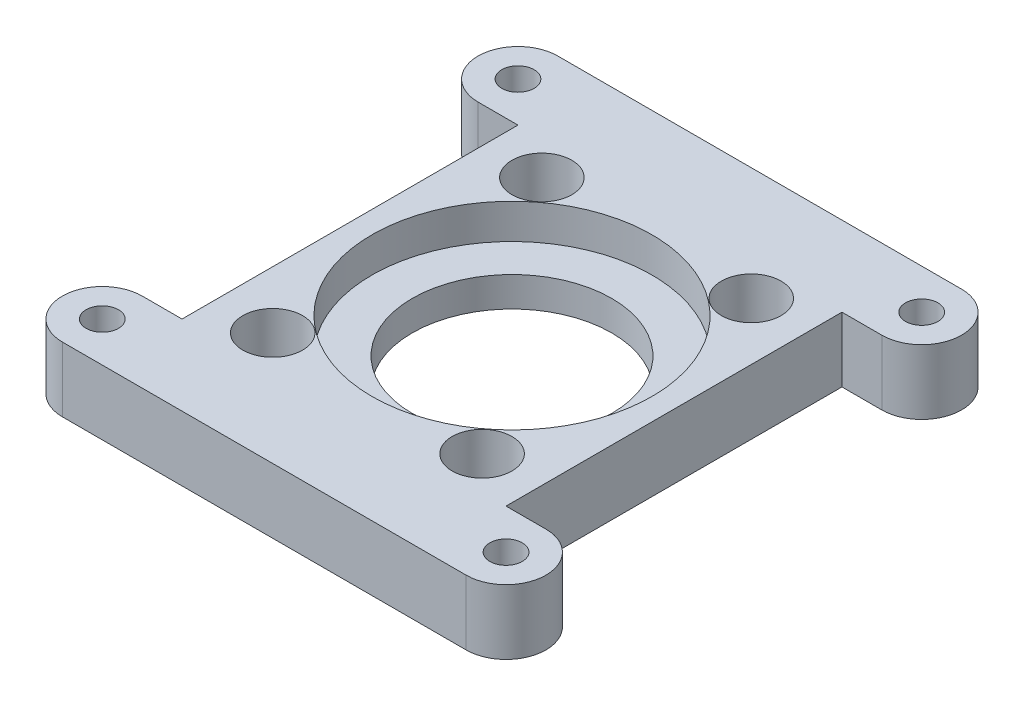
from build123d import *
from build123d.topology import SkipClean

# Parameters (mm, degrees)
SKETCH1_R            = 1.375
SKETCH1_R_2          = 1.460845326
SKETCH1_R_3          = 1.480655282
BOSS_EXTRUDE1_DEPTH  = 15
BOSS_EXTRUDE2_START  = -8
SKETCH2_R            = 14
SKETCH2_R_2          = 10
BOSS_EXTRUDE2_DEPTH  = 8
CUT_EXTRUDE1_START   = -3
SKETCH3_R            = 14
SKETCH3_R_2          = 10
CUT_EXTRUDE1_DEPTH   = 3
SKETCH5_R            = 1.480655282
SKETCH5_R_2          = 1.375
SKETCH5_R_3          = 1.460845326
BOSS_EXTRUDE3_DEPTH  = 0.5
SKETCH6_W            = 32.415484222
SKETCH6_H            = 34.71462202
CUT_EXTRUDE2_DEPTH   = 7
SKETCH7_W            = 33.435139342
SKETCH7_H            = 35.82697306
CUT_EXTRUDE3_DEPTH   = 2
BOSS_EXTRUDE4_DEPTH  = 6.5
SKETCH9_R            = 3.5
SKETCH9_R_2          = 1.625
CUT_EXTRUDE4_DEPTH   = 3
SKETCH10_R           = 3
CUT_EXTRUDE5_DEPTH   = 28
SKETCH11_R           = 14.05
CUT_EXTRUDE6_DEPTH   = 3.5
SKETCH12_W           = 30
SKETCH12_H           = 8
SKETCH12_H_2         = 7.99555269
BOSS_EXTRUDE5_DEPTH  = 6.5
BOSS_EXTRUDE8_DEPTH  = 6.5
BOSS_EXTRUDE9_START  = -3
SKETCH15_R           = 14.05
SKETCH15_R_2         = 14
BOSS_EXTRUDE9_DEPTH  = 3
SKETCH16_R           = 4
SKETCH16_R_2         = 1.625
BOSS_EXTRUDE10_DEPTH = 6.5


with BuildPart() as part:
    # Sketch1 → Boss-Extrude1 (new body)
    with BuildSketch(Plane(origin=(0, 0, 0), x_dir=(1, 0, 0), z_dir=(0, 1, 0))):
        with BuildLine():
            Line((-15, -16.85), (15, -16.85))
            Line((15, -16.85), (15, 16.85))
            Line((15, 16.85), (-15, 16.85))
            Line((-15, 16.85), (-15, 2.633913438))
            ThreePointArc((-15, 2.633913438), (0.072875656, 13.937359865), (12.75, 0))
            ThreePointArc((12.75, 0), (0.072875656, -13.937359865), (-15, -2.633913438))
            Line((-15, -2.633913438), (-15, -16.85))
        make_face()
        with Locations(Location((-11.75, -13.5, 0), (0, 0, 270))):
            Circle(SKETCH1_R, mode=Mode.SUBTRACT)
        with Locations(Location((9.25, -13.5, 0), (0, 0, 270))):
            Circle(SKETCH1_R_2, mode=Mode.SUBTRACT)
        with Locations(Location((-11.75, 13.5, 0), (0, 0, 270))):
            Circle(SKETCH1_R, mode=Mode.SUBTRACT)
        with Locations(Location((9.25, 13.5, 0), (0, 0, 270))):
            Circle(SKETCH1_R_3, mode=Mode.SUBTRACT)
    extrude(amount=BOSS_EXTRUDE1_DEPTH)

    # Sketch2 → Boss-Extrude2 (add)
    with BuildSketch(Plane(origin=(0, 15, 0), x_dir=(1, 0, 0), z_dir=(0, 1, 0)).offset(BOSS_EXTRUDE2_START)):
        with Locations((-1.25, 0)):
            Circle(SKETCH2_R)
        with Locations(Location((-1.25, 0, 0), (0, 0, 270))):
            Circle(SKETCH2_R_2, mode=Mode.SUBTRACT)
    extrude(amount=BOSS_EXTRUDE2_DEPTH)

    # Sketch3 → Cut-Extrude1 (cut)
    with BuildSketch(Plane(origin=(0, 15, 0), x_dir=(1, 0, 0), z_dir=(0, 1, 0)).offset(CUT_EXTRUDE1_START)):
        with Locations((-1.25, 0)):
            Circle(SKETCH3_R)
        with Locations(Location((-1.25, 0, 0), (0, 0, 270))):
            Circle(SKETCH3_R_2, mode=Mode.SUBTRACT)
    extrude(amount=CUT_EXTRUDE1_DEPTH, mode=Mode.SUBTRACT)

    # Sketch5 → Boss-Extrude3 (add)
    with BuildSketch(Plane(origin=(0, 15, 0), x_dir=(1, 0, 0), z_dir=(0, 1, 0))):
        with BuildLine():
            Line((-15, 16.85), (-15, 2.633913438))
            ThreePointArc((-15, 2.633913438), (12.75, 0), (-15, -2.633913438))
            Line((-15, -2.633913438), (-15, -16.85))
            Line((-15, -16.85), (15, -16.85))
            Line((15, -16.85), (15, 16.85))
            Line((15, 16.85), (-15, 16.85))
        make_face()
        with Locations(Location((9.25, 13.5, 0), (0, 0, 270))):
            Circle(SKETCH5_R, mode=Mode.SUBTRACT)
        with Locations(Location((-11.75, -13.5, 0), (0, 0, 270))):
            Circle(SKETCH5_R_2, mode=Mode.SUBTRACT)
        with Locations(Location((-11.75, 13.5, 0), (0, 0, 270))):
            Circle(SKETCH5_R_2, mode=Mode.SUBTRACT)
        with Locations(Location((9.25, -13.5, 0), (0, 0, 270))):
            Circle(SKETCH5_R_3, mode=Mode.SUBTRACT)
    extrude(amount=BOSS_EXTRUDE3_DEPTH)

    # Sketch6 → Cut-Extrude2 (cut)
    with BuildSketch(Plane.XZ):
        Rectangle(SKETCH6_W, SKETCH6_H)
    extrude(amount=-CUT_EXTRUDE2_DEPTH, mode=Mode.SUBTRACT)

    # Sketch7 → Cut-Extrude3 (cut)
    with BuildSketch(Plane.XZ.offset(-7)):
        Rectangle(SKETCH7_W, SKETCH7_H)
    extrude(amount=-CUT_EXTRUDE3_DEPTH, mode=Mode.SUBTRACT)

    # Sketch8 → Boss-Extrude4 (add)
    with BuildSketch(Plane.XZ.offset(-9)):
        with BuildLine():
            Line((3.5, 16.85), (3.5, 20.35))
            ThreePointArc((3.5, 20.35), (2.474873725, 17.875126257), (-2.6e-08, 16.85))
            Line((-2.6e-08, 16.85), (3.5, 16.85))
        make_face()
        with BuildLine():
            ThreePointArc((-2.6e-08, 16.85), (-2.474873743, 17.875126275), (-3.5, 20.35))
            Line((-3.5, 20.35), (-3.5, 16.85))
            Line((-3.5, 16.85), (-2.6e-08, 16.85))
        make_face()
        with BuildLine():
            ThreePointArc((-1.625, 20.35), (0, 21.975), (1.625, 20.35))
            Line((1.625, 20.35), (3.5, 20.35))
            ThreePointArc((3.5, 20.35), (0, 23.85), (-3.5, 20.35))
            Line((-3.5, 20.35), (-1.625, 20.35))
        make_face()
        with BuildLine():
            Line((3.5, 20.35), (1.625, 20.35))
            ThreePointArc((1.625, 20.35), (0, 18.725), (-1.625, 20.35))
            Line((-1.625, 20.35), (-3.5, 20.35))
            ThreePointArc((-3.5, 20.35), (-2.474873743, 17.875126275), (-2.6e-08, 16.85))
            ThreePointArc((-2.6e-08, 16.85), (2.474873725, 17.875126257), (3.5, 20.35))
        make_face()
        with BuildLine():
            Line((3.5, -20.35), (3.5, -16.85))
            Line((3.5, -16.85), (0, -16.85))
            ThreePointArc((0, -16.85), (2.474873734, -17.875126266), (3.5, -20.35))
        make_face()
        with BuildLine():
            ThreePointArc((-3.5, -20.35), (-2.474873734, -17.875126266), (0, -16.85))
            Line((0, -16.85), (-3.5, -16.85))
            Line((-3.5, -16.85), (-3.5, -20.35))
        make_face()
        with BuildLine():
            ThreePointArc((-3.5, -20.35), (0, -23.85), (3.5, -20.35))
            Line((3.5, -20.35), (1.625, -20.35))
            ThreePointArc((1.625, -20.35), (0, -21.975), (-1.625, -20.35))
            Line((-1.625, -20.35), (-3.5, -20.35))
        make_face()
        with BuildLine():
            Line((1.625, -20.35), (3.5, -20.35))
            ThreePointArc((3.5, -20.35), (2.474873734, -17.875126266), (0, -16.85))
            ThreePointArc((0, -16.85), (-2.474873734, -17.875126266), (-3.5, -20.35))
            Line((-3.5, -20.35), (-1.625, -20.35))
            ThreePointArc((-1.625, -20.35), (0, -18.725), (1.625, -20.35))
        make_face()
    extrude(amount=-BOSS_EXTRUDE4_DEPTH)

    # Sketch9 → Cut-Extrude4 (cut)
    # profile 1 of 2: a face of its own
    with BuildSketch(Plane.XZ.offset(-9)):
        with Locations((0, 20.35)):
            Circle(SKETCH9_R)
        with Locations(Location((0, 20.35, 0), (0, 0, 270))):
            Circle(SKETCH9_R_2, mode=Mode.SUBTRACT)
    # profile 2 of 2: a face of its own
    with BuildSketch(Plane.XZ.offset(-9)):
        with Locations((0, -20.35)):
            Circle(SKETCH9_R)
        with Locations(Location((0, -20.35, 0), (0, 0, 270))):
            Circle(SKETCH9_R_2, mode=Mode.SUBTRACT)
    extrude(amount=-CUT_EXTRUDE4_DEPTH, mode=Mode.SUBTRACT)

    # Sketch10 → Cut-Extrude5 (cut)
    with BuildSketch(Plane.XZ.offset(-9)):
        with Locations(Location((-11.75, 13.5, 0), (0, 0, 270))):
            Circle(SKETCH10_R)
        with Locations(Location((9.25, 13.5, 0), (0, 0, 270))):
            Circle(SKETCH10_R)
        with Locations(Location((9.25, -13.5, 0), (0, 0, 270))):
            Circle(SKETCH10_R)
        with Locations(Location((-11.75, -13.5, 0), (0, 0, 270))):
            Circle(SKETCH10_R)
    extrude(amount=-CUT_EXTRUDE5_DEPTH, mode=Mode.SUBTRACT)

    # Sketch11 → Cut-Extrude6 (cut)
    with BuildSketch(Plane(origin=(0, 15.5, 0), x_dir=(1, 0, 0), z_dir=(0, 1, 0))):
        with Locations((-1.25, 0)):
            Circle(SKETCH11_R)
    extrude(amount=-CUT_EXTRUDE6_DEPTH, mode=Mode.SUBTRACT)

    # Sketch12 → Boss-Extrude5 (add)
    with BuildSketch(Plane(origin=(0, 15.5, 0), x_dir=(1, 0, 0), z_dir=(0, 1, 0))):
        with Locations((0, 20.85)):
            Rectangle(SKETCH12_W, SKETCH12_H)
        with Locations((0, -20.847776345)):
            Rectangle(SKETCH12_W, SKETCH12_H_2)
    extrude(amount=-BOSS_EXTRUDE5_DEPTH)

    # Sketch13 → Boss-Extrude8 (add)
    with SkipClean():  # the faces are left unmerged after this step: merging them gives an invalid solid
        with BuildSketch(Plane(origin=(0, 15.5, 0), x_dir=(1, 0, 0), z_dir=(0, 1, 0))):
            with BuildLine():
                Line((-15, 2.887905816), (-15, 24.85))
                Line((-15, 24.85), (-17.5, 24.85))
                Line((-17.5, 24.85), (-17.5, -24.84555269))
                Line((-17.5, -24.84555269), (-15, -24.84555269))
                Line((-15, -24.84555269), (-15, -2.887905816))
                ThreePointArc((-15, -2.887905816), (-15.3, 0), (-15, 2.887905816))
            make_face()
        extrude(amount=-BOSS_EXTRUDE8_DEPTH)

    # Sketch15 → Boss-Extrude9 (add)
    with BuildSketch(Plane.XZ.offset(-9).offset(BOSS_EXTRUDE9_START)):
        with Locations(Location((-1.25, 0, 0), (0, 0, 90))):
            Circle(SKETCH15_R)
        with Locations((-1.25, 0)):
            Circle(SKETCH15_R_2, mode=Mode.SUBTRACT)
    extrude(amount=BOSS_EXTRUDE9_DEPTH)

    # Sketch16 → Boss-Extrude10 (add)
    # profile 1 of 12: a face of its own
    with SkipClean():  # the faces are left unmerged after this step: merging them gives an invalid solid
        with BuildSketch(Plane(origin=(0, 15.5, 0), x_dir=(1, 0, 0), z_dir=(0, 1, 0))):
            with BuildLine():
                Line((-17.5, 20.85), (-17.5, 24.85))
                Line((-17.5, 24.85), (-21.5, 24.85))
                ThreePointArc((-21.5, 24.85), (-18.671572875, 23.678427125), (-17.5, 20.85))
            make_face()
        # profile 2 of 12: a face of its own
        with BuildSketch(Plane(origin=(0, 15.5, 0), x_dir=(1, 0, 0), z_dir=(0, 1, 0))):
            with BuildLine():
                Line((-17.5, 16.85), (-17.5, 20.85))
                ThreePointArc((-17.5, 20.85), (-18.671572875, 18.021572875), (-21.5, 16.85))
                Line((-21.5, 16.85), (-17.5, 16.85))
            make_face()
        # profile 3 of 12: a face of its own
        with BuildSketch(Plane(origin=(0, 15.5, 0), x_dir=(1, 0, 0), z_dir=(0, 1, 0))):
            with Locations((-21.5, 20.85)):
                Circle(SKETCH16_R)
            with Locations(Location((-21.5, 20.85, 0), (0, 0, 270))):
                Circle(SKETCH16_R_2, mode=Mode.SUBTRACT)
        # profile 4 of 12: a face of its own
        with BuildSketch(Plane(origin=(0, 15.5, 0), x_dir=(1, 0, 0), z_dir=(0, 1, 0))):
            with Locations((19, 20.85)):
                Circle(SKETCH16_R)
            with Locations(Location((19, 20.85, 0), (0, 0, 270))):
                Circle(SKETCH16_R_2, mode=Mode.SUBTRACT)
        # profile 5 of 12: a face of its own
        with BuildSketch(Plane(origin=(0, 15.5, 0), x_dir=(1, 0, 0), z_dir=(0, 1, 0))):
            with BuildLine():
                ThreePointArc((19, 16.85), (16.171572875, 18.021572875), (15, 20.85))
                Line((15, 20.85), (15, 16.85))
                Line((15, 16.85), (19, 16.85))
            make_face()
        # profile 6 of 12: a face of its own
        with BuildSketch(Plane(origin=(0, 15.5, 0), x_dir=(1, 0, 0), z_dir=(0, 1, 0))):
            with BuildLine():
                Line((19, 24.85), (15, 24.85))
                Line((15, 24.85), (15, 20.85))
                ThreePointArc((15, 20.85), (16.171572875, 23.678427125), (19, 24.85))
            make_face()
        # profile 7 of 12: a face of its own
        with BuildSketch(Plane(origin=(0, 15.5, 0), x_dir=(1, 0, 0), z_dir=(0, 1, 0))):
            with BuildLine():
                Line((-17.5, -20.84555269), (-17.5, -16.84555269))
                Line((-17.5, -16.84555269), (-21.5, -16.84555269))
                ThreePointArc((-21.5, -16.84555269), (-18.671572875, -18.017125565), (-17.5, -20.84555269))
            make_face()
        # profile 8 of 12: a face of its own
        with BuildSketch(Plane(origin=(0, 15.5, 0), x_dir=(1, 0, 0), z_dir=(0, 1, 0))):
            with BuildLine():
                Line((-17.5, -24.84555269), (-17.5, -20.84555269))
                ThreePointArc((-17.5, -20.84555269), (-18.671572875, -23.673979815), (-21.5, -24.84555269))
                Line((-21.5, -24.84555269), (-17.5, -24.84555269))
            make_face()
        # profile 9 of 12: a face of its own
        with BuildSketch(Plane(origin=(0, 15.5, 0), x_dir=(1, 0, 0), z_dir=(0, 1, 0))):
            with Locations((-21.5, -20.84555269)):
                Circle(SKETCH16_R)
            with Locations(Location((-21.5, -20.84555269, 0), (0, 0, 270))):
                Circle(SKETCH16_R_2, mode=Mode.SUBTRACT)
        # profile 10 of 12: a face of its own
        with BuildSketch(Plane(origin=(0, 15.5, 0), x_dir=(1, 0, 0), z_dir=(0, 1, 0))):
            with BuildLine():
                Line((19, -16.84555269), (15, -16.84555269))
                Line((15, -16.84555269), (15, -20.84555269))
                ThreePointArc((15, -20.84555269), (16.171572875, -18.017125565), (19, -16.84555269))
            make_face()
        # profile 11 of 12: a face of its own
        with BuildSketch(Plane(origin=(0, 15.5, 0), x_dir=(1, 0, 0), z_dir=(0, 1, 0))):
            with BuildLine():
                ThreePointArc((19, -24.84555269), (16.171572875, -23.673979815), (15, -20.84555269))
                Line((15, -20.84555269), (15, -24.84555269))
                Line((15, -24.84555269), (19, -24.84555269))
            make_face()
        # profile 12 of 12: a face of its own
        with BuildSketch(Plane(origin=(0, 15.5, 0), x_dir=(1, 0, 0), z_dir=(0, 1, 0))):
            with Locations((19, -20.84555269)):
                Circle(SKETCH16_R)
            with Locations(Location((19, -20.84555269, 0), (0, 0, 270))):
                Circle(SKETCH16_R_2, mode=Mode.SUBTRACT)
        extrude(amount=-BOSS_EXTRUDE10_DEPTH)


solid = part.part
